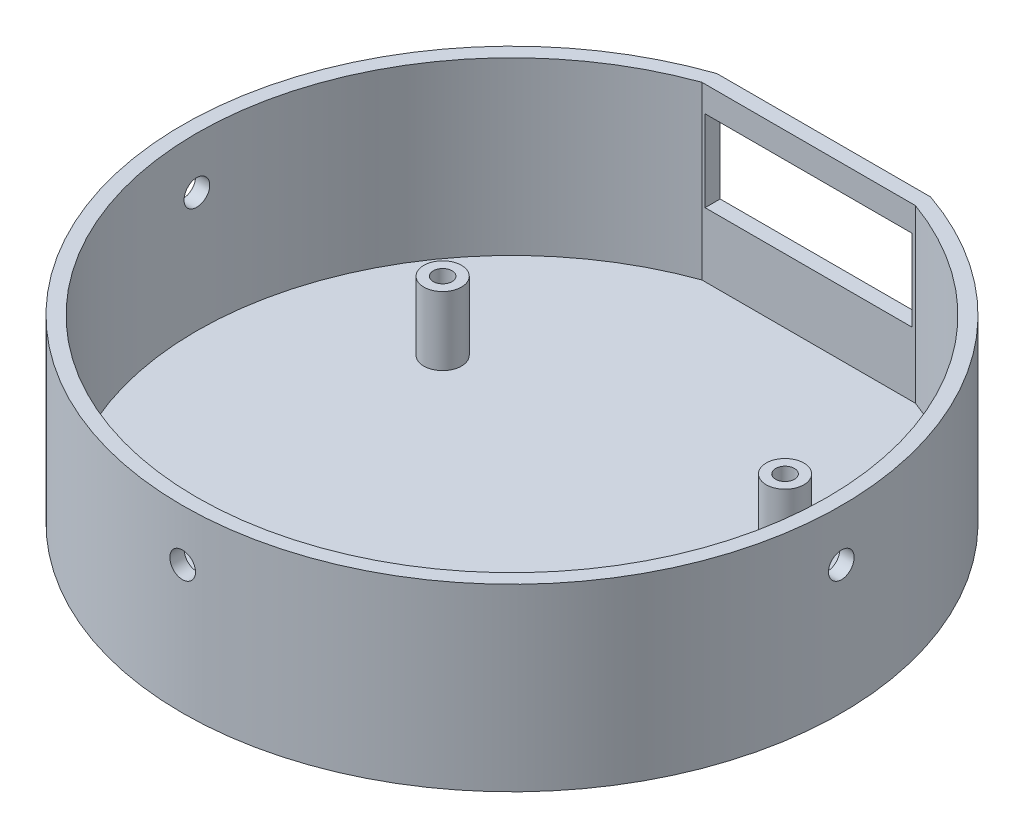
from build123d import *

# Parameters (mm, degrees)
SKETCH1_R               = 2.2
SKETCH1_R_2             = 1.1
BOSS_EXTRUDE3_DEPTH     = 8
BOSS_EXTRUDE3_2_DEPTH   = 8
BOSS_EXTRUDE4_DEPTH     = 20
BOSS_EXTRUDE8_DEPTH     = 1
SKETCH2_W               = 24.2
SKETCH2_H               = 9.5
CUT_EXTRUDE2_DEPTH      = 9
SKETCH1_11_R            = 2.2
SKETCH1_11_R_2          = 1.1
BOSS_EXTRUDE9_DEPTH     = 8
CUT_EXTRUDE3_DEPTH      = 58
CUT_EXTRUDE3_DEPTH_BACK = 52
SKETCH3_R               = 1.5
CUT_EXTRUDE4_DEPTH      = 52
CUT_EXTRUDE4_DEPTH_BACK = 10
SKETCH4_R               = 1.5


with BuildPart() as part:
    # Sketch1 → Boss-Extrude3 (new body)
    with BuildSketch(Plane(origin=(0, 0, 0), x_dir=(1, 0, 0), z_dir=(0, 1, 0))):
        with Locations(Location((-20, 11.9, 0), (0, 0, 270))):
            Circle(SKETCH1_R)
        with Locations(Location((-20, 11.9, 0), (0, 0, 270))):
            Circle(SKETCH1_R_2, mode=Mode.SUBTRACT)
    extrude(amount=BOSS_EXTRUDE3_DEPTH)



with BuildPart() as body_2:
    # Sketch1 → Boss-Extrude3 2 (new body)
    with BuildSketch(Plane(origin=(0, 0, 0), x_dir=(1, 0, 0), z_dir=(0, 1, 0))):
        with Locations(Location((20, 11.9, 0), (0, 0, 270))):
            Circle(SKETCH1_R)
        with Locations(Location((20, 11.9, 0), (0, 0, 270))):
            Circle(SKETCH1_R_2, mode=Mode.SUBTRACT)
    extrude(amount=BOSS_EXTRUDE3_2_DEPTH)


with BuildPart() as body_3:
    # Sketch1<6> → Boss-Extrude4 (new body)
    with BuildSketch(Plane(origin=(0, 0, 0), x_dir=(1, 0, 0), z_dir=(0, 1, 0))):
        with BuildLine():
            Line((12.480384609, 36.42101042), (-12.480384609, 36.42101042))
            ThreePointArc((-12.480384609, 36.42101042), (0, -38.5), (12.480384609, 36.42101042))
        make_face()
        with BuildLine():
            ThreePointArc((-12.480384609, 34.660769231), (0, -36.839230769), (12.480384609, 34.660769231))
            Line((12.480384609, 34.660769231), (-12.480384609, 34.660769231))
        make_face(mode=Mode.SUBTRACT)
    extrude(amount=BOSS_EXTRUDE4_DEPTH)


with BuildPart() as part_1:
    add(part.part)

    add(body_2.part)  # Boss-Extrude8 merges body 2

    add(body_3.part)  # Boss-Extrude8 merges body 3
    # Sketch1<10> → Boss-Extrude8 (add)
    with BuildSketch(Plane(origin=(0, 0, 0), x_dir=(1, 0, 0), z_dir=(0, 1, 0))):
        with BuildLine():
            Line((12.480384609, 36.42101042), (-12.480384609, 36.42101042))
            ThreePointArc((-12.480384609, 36.42101042), (0, -38.5), (12.480384609, 36.42101042))
        make_face()
    extrude(amount=-BOSS_EXTRUDE8_DEPTH)

    # Sketch2 → Cut-Extrude2 (cut)
    with BuildSketch(Plane.XY.offset(-34.660769231)):
        with Locations((0, 12.25)):
            Rectangle(SKETCH2_W, SKETCH2_H)
    extrude(amount=-CUT_EXTRUDE2_DEPTH, mode=Mode.SUBTRACT)

    # Sketch1<11> → Boss-Extrude9 (add)
    with BuildSketch(Plane(origin=(0, 0, 0), x_dir=(1, 0, 0), z_dir=(0, 1, 0))):
        with Locations(Location((7.6, -26.129462263, 0), (0, 0, 270))):
            Circle(SKETCH1_11_R)
        with Locations(Location((7.6, -26.129462263, 0), (0, 0, 270))):
            Circle(SKETCH1_11_R_2, mode=Mode.SUBTRACT)
    extrude(amount=BOSS_EXTRUDE9_DEPTH)

    # Sketch3 → Cut-Extrude3 (cut, two sides: drawn at the far end of the back side and taken through both)
    with BuildSketch(Plane(origin=(0, 0, 0), x_dir=(0, 0, -1), z_dir=(1, 0, 0)).offset(-CUT_EXTRUDE3_DEPTH_BACK)):
        with Locations(Location((0, 14, 0), (0, 0, 180))):
            Circle(SKETCH3_R)
    extrude(amount=CUT_EXTRUDE3_DEPTH + CUT_EXTRUDE3_DEPTH_BACK, mode=Mode.SUBTRACT)

    # Sketch4 → Cut-Extrude4 (cut, two sides: drawn at the far end of the back side and taken through both)
    with BuildSketch(Plane.XY.offset(-CUT_EXTRUDE4_DEPTH_BACK)):
        with Locations((0, 14)):
            Circle(SKETCH4_R)
    extrude(amount=CUT_EXTRUDE4_DEPTH + CUT_EXTRUDE4_DEPTH_BACK, mode=Mode.SUBTRACT)


solid = part_1.part
